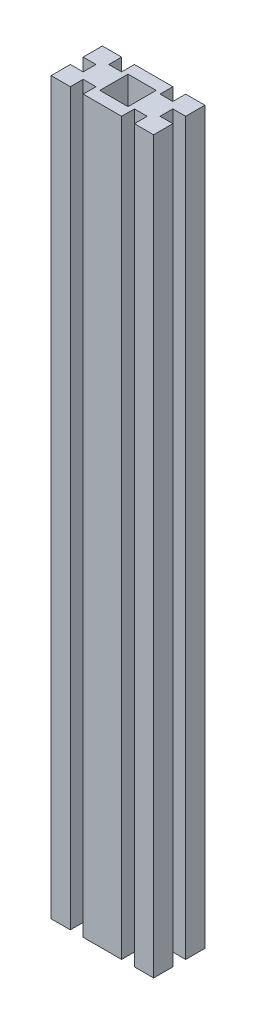
from build123d import *

# Parameters (mm, degrees)
SKETCH1_W       = 40
SKETCH1_H       = 20
BODY_DEPTH      = 285
SKETCH2_W       = 5
SKETCH2_H       = 5
SKETCH2_W_2     = 11
SKETCH2_H_2     = 11
PROFILAGE_DEPTH = 286.875847178


with BuildPart() as part:
    # Sketch1 → Body (new body)
    with BuildSketch(Plane(origin=(0, 0, 0), x_dir=(1, 0, 0), z_dir=(0, 1, 0))):
        Rectangle(SKETCH1_W, SKETCH1_H)
    extrude(amount=BODY_DEPTH)

    # Sketch2 → Profilage (cut, through all)
    with BuildSketch(Plane(origin=(0, 285, 0), x_dir=(1, 0, 0), z_dir=(0, 1, 0))):
        with Locations((-10, 7.5)):
            Rectangle(SKETCH2_W, SKETCH2_H)
        with Locations((-17.5, 0)):
            Rectangle(SKETCH2_W, SKETCH2_H)
        with Locations((-10, -7.5)):
            Rectangle(SKETCH2_W, SKETCH2_H)
        with Locations((10, -7.5)):
            Rectangle(SKETCH2_W, SKETCH2_H)
        with Locations((17.5, 0)):
            Rectangle(SKETCH2_W, SKETCH2_H)
        with Locations((10, 7.5)):
            Rectangle(SKETCH2_W, SKETCH2_H)
        Rectangle(SKETCH2_W_2, SKETCH2_H_2)
    extrude(amount=-PROFILAGE_DEPTH, mode=Mode.SUBTRACT)


solid = part.part
